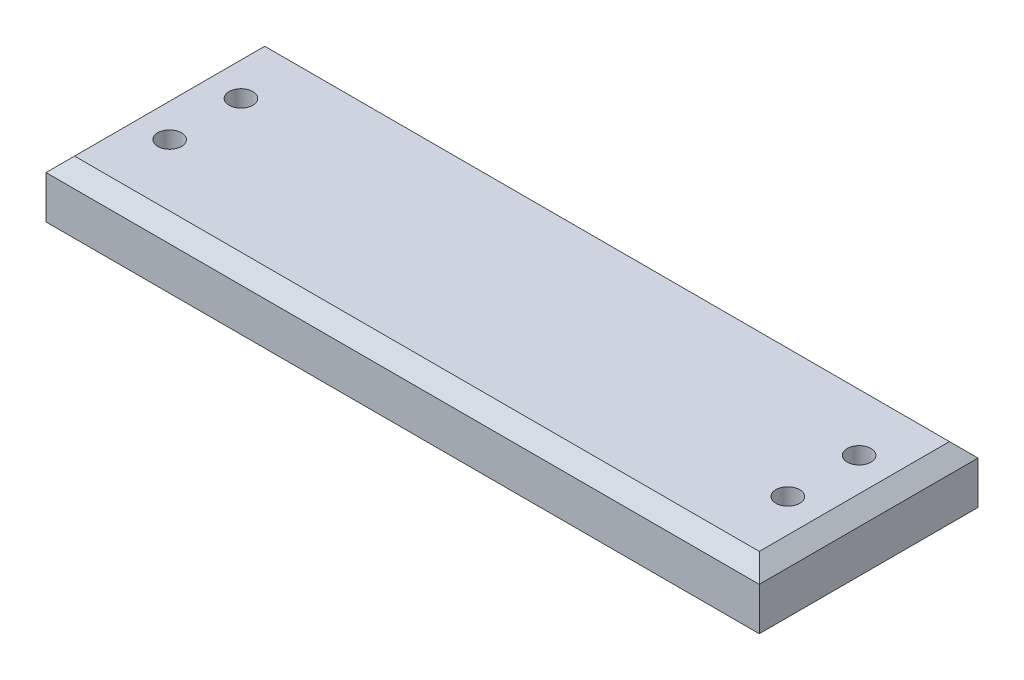
from build123d import *

# Parameters (mm, degrees)
SKETCH2_W           = 150
SKETCH2_H           = 46
BOSS_EXTRUDE1_DEPTH = 6
CHAMFER2_SIZE       = 3
SKETCH3_R           = 2.5
CUT_EXTRUDE1_DEPTH  = 80.359939516
CHAMFER3_SIZE       = 1.5


with BuildPart() as part:
    # Sketch2 → Boss-Extrude1 (new, symmetric)
    with BuildSketch(Plane(origin=(0, 0, 0), x_dir=(1, 0, 0), z_dir=(0, 1, 0))):
        Rectangle(SKETCH2_W, SKETCH2_H)
    extrude(amount=BOSS_EXTRUDE1_DEPTH, both=True)

    # Chamfer2
    chamfer2_edges = [part.edges().sort_by_distance(p)[0] for p in [
        (-75, 6, 0),
        (0, 6, 23),
        (75, 6, 0),
        (0, 6, -23),
    ]]
    chamfer(chamfer2_edges, length=CHAMFER2_SIZE)

    # Sketch3 → Cut-Extrude1 (cut, through all)
    with BuildSketch(Plane(origin=(0, 6, 0), x_dir=(1, 0, 0), z_dir=(0, 1, 0))):
        with Locations(Location((-65, 8, 0), (0, 0, 270))):
            Circle(SKETCH3_R)
        with Locations(Location((-65, -7, 0), (0, 0, 270))):
            Circle(SKETCH3_R)
        with Locations(Location((65, 8, 0), (0, 0, 270))):
            Circle(SKETCH3_R)
        with Locations(Location((65, -7, 0), (0, 0, 270))):
            Circle(SKETCH3_R)
    extrude(amount=-CUT_EXTRUDE1_DEPTH, mode=Mode.SUBTRACT)

    # Chamfer3
    chamfer3_edges = [part.edges().sort_by_distance(p)[0] for p in [
        (-65, -6, 4.5),
        (65, -6, -10.5),
        (65, -6, 4.5),
        (-65, -6, -10.5),
    ]]
    chamfer(chamfer3_edges, length=CHAMFER3_SIZE)


solid = part.part
